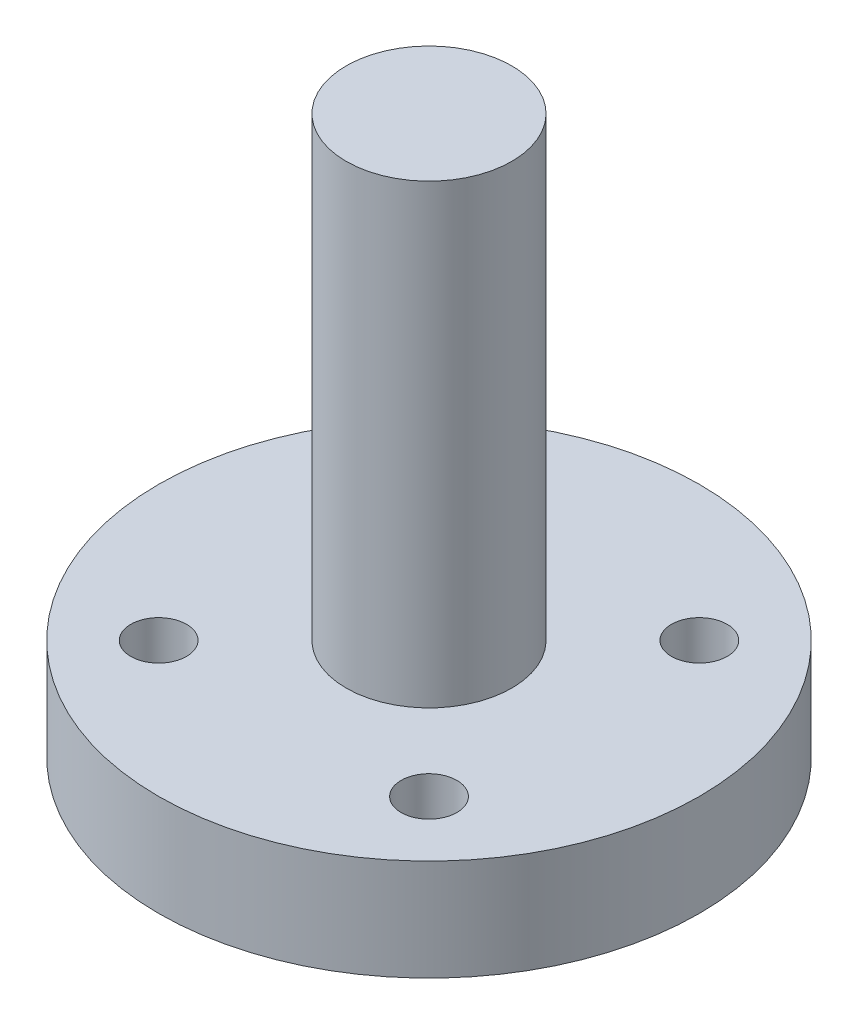
from build123d import *

# Parameters (mm, degrees)
SKETCH1_R                   = 16
BOSS_EXTRUDE1_DEPTH         = 6
TAP_DRILL_FOR_M4X0_7_TAP1_D = 3.3
SKETCH3_R                   = 4.9
BOSS_EXTRUDE2_DEPTH         = 27


with BuildPart() as part:
    # Sketch1 → Boss-Extrude1 (new body)
    with BuildSketch(Plane(origin=(0, 0, 0), x_dir=(1, 0, 0), z_dir=(0, 1, 0))):
        with Locations(Location((0, 0, 0), (0, 0, 270))):
            Circle(SKETCH1_R)
    extrude(amount=BOSS_EXTRUDE1_DEPTH)

    # Tap Drill for M4x0.7 Tap1 (through all)
    with Locations(Plane(origin=(0, 0, 0), x_dir=(-1, 0, 0), z_dir=(0, -1, 0))):
        with Locations((-8, 8), (-8, -8), (8, -8), (8, 8)):
            Hole(TAP_DRILL_FOR_M4X0_7_TAP1_D / 2)

    # Sketch3 → Boss-Extrude2 (add)
    with BuildSketch(Plane(origin=(0, 6, 0), x_dir=(1, 0, 0), z_dir=(0, 1, 0))):
        with Locations(Location((0, 0, 0), (0, 0, 270))):
            Circle(SKETCH3_R)
    extrude(amount=BOSS_EXTRUDE2_DEPTH)


solid = part.part
